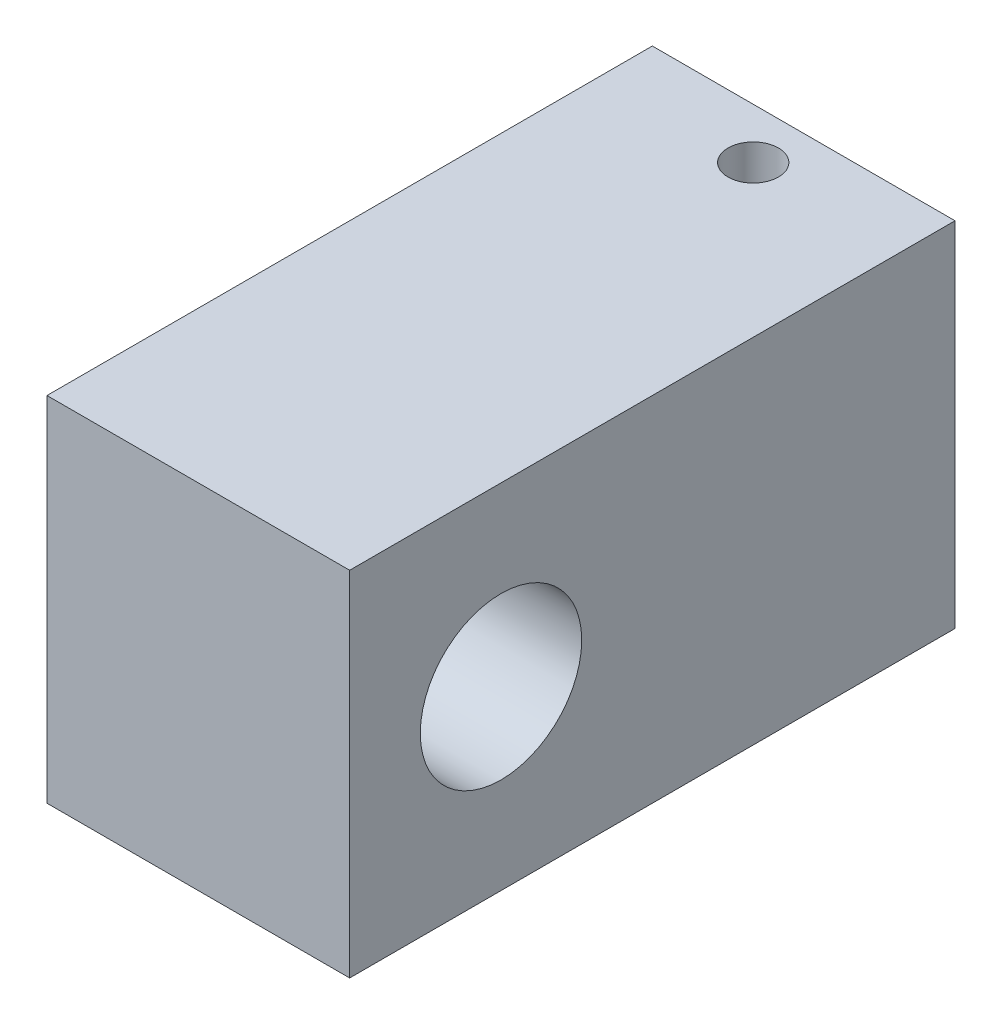
from build123d import *

# Parameters (mm, degrees)
SKETCH1_W           = 30
SKETCH1_H           = 35
BOSS_EXTRUDE1_DEPTH = 60
SKETCH2_R           = 8
CUT_EXTRUDE1_DEPTH  = 76.663729752
SKETCH3_R           = 5
CUT_EXTRUDE2_DEPTH  = 10
SKETCH5_R           = 2.5
CUT_EXTRUDE4_DEPTH  = 15


with BuildPart() as part:
    # Sketch1 → Boss-Extrude1 (new body)
    with BuildSketch(Plane.XY):
        with Locations((15, 17.5)):
            Rectangle(SKETCH1_W, SKETCH1_H)
    extrude(amount=BOSS_EXTRUDE1_DEPTH)

    # Sketch2 → Cut-Extrude1 (cut, through all)
    with BuildSketch(Plane(origin=(30, 0, 0), x_dir=(0, 0, -1), z_dir=(1, 0, 0))):
        with Locations(Location((-45, 17.5, 0), (0, 0, 90))):
            Circle(SKETCH2_R)
    extrude(amount=-CUT_EXTRUDE1_DEPTH, mode=Mode.SUBTRACT)

    # Sketch3 → Cut-Extrude2 (cut)
    with BuildSketch(Plane(origin=(0, 0, 0), x_dir=(-1, 0, 0), z_dir=(0, 0, -1))):
        with Locations((-15, 17.5)):
            Circle(SKETCH3_R)
    extrude(amount=-CUT_EXTRUDE2_DEPTH, mode=Mode.SUBTRACT)

    # Sketch5 → Cut-Extrude4 (cut)
    with BuildSketch(Plane(origin=(0, 35, 0), x_dir=(1, 0, 0), z_dir=(0, 1, 0))):
        with Locations(Location((15, -5, 0), (0, 0, 270))):
            Circle(SKETCH5_R)
    extrude(amount=-CUT_EXTRUDE4_DEPTH, mode=Mode.SUBTRACT)


solid = part.part
